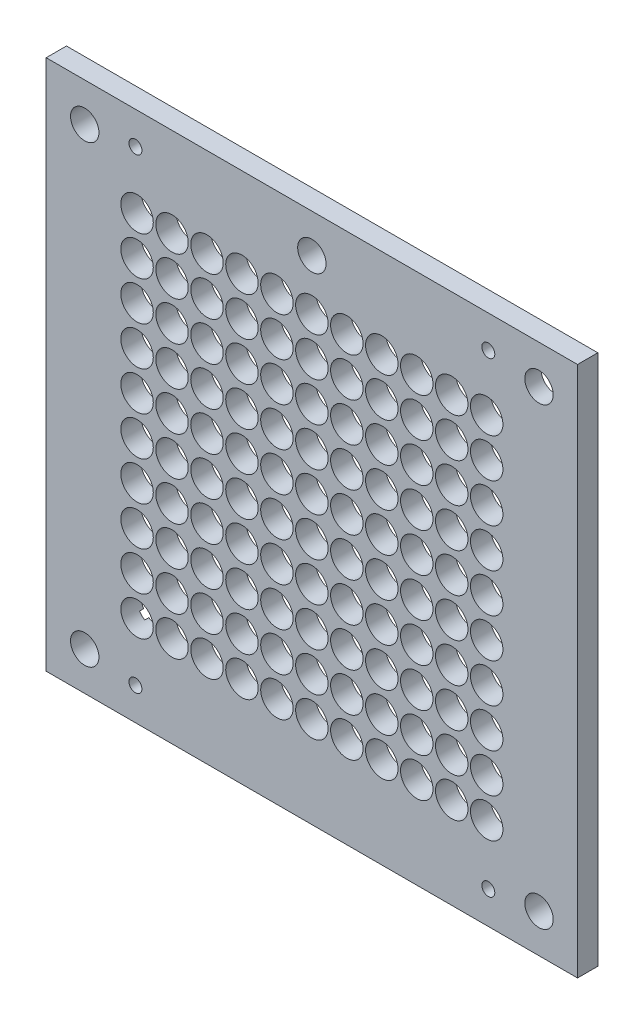
from build123d import *

# Parameters (mm, degrees)
SKIZZE2_W                                            = 131
SKIZZE2_H                                            = 131
AUFSATZ_LINEAR_AUSTRAGEN1_DEPTH                      = 5
SKIZZE3_R                                            = 3.5
SCHNITT_LINEAR_AUSTRAGEN1_DEPTH                      = 5
SKIZZE4_R                                            = 4
SCHNITT_LINEAR_AUSTRAGEN2_DEPTH                      = 5
LINEARES_MUSTER1_COUNT                               = 6
LINEARES_MUSTER1_PITCH                               = 8.62
LINEARES_MUSTER1_COUNT_DIR2                          = 10
LINEARES_MUSTER1_PITCH_DIR2                          = 9.611111111
LINEARES_MUSTER2_COUNT                               = 6
LINEARES_MUSTER2_PITCH                               = 8.62
LINEARES_MUSTER2_COUNT_DIR2                          = 10
LINEARES_MUSTER2_PITCH_DIR2                          = 9.611111111
SKIZZE5_R                                            = 6
SCHNITT_LINEAR_AUSTRAGEN3_DEPTH                      = 1
SKIZZE6_R                                            = 3.5
SCHNITT_LINEAR_AUSTRAGEN4_DEPTH                      = 5
SKIZZE7_R                                            = 3
SCHNITT_LINEAR_AUSTRAGEN5_DEPTH                      = 1.2
FORMSENKUNG_F_R_M3_SENKSCHRAUBE_MIT_INNE_D           = 3.2
FORMSENKUNG_F_R_M3_SENKSCHRAUBE_MIT_INNE_CSINK_D     = 7.94
FORMSENKUNG_F_R_M3_SENKSCHRAUBE_MIT_INNE_CSINK_ANGLE = 90


with BuildPart() as part:
    # Skizze2 → Aufsatz-Linear austragen1 (new body)
    with BuildSketch(Plane.XY):
        Rectangle(SKIZZE2_W, SKIZZE2_H)
    extrude(amount=AUFSATZ_LINEAR_AUSTRAGEN1_DEPTH)

    # Skizze3 → Schnitt-Linear austragen1 (cut)
    with BuildSketch(Plane(origin=(0, 0, 0), x_dir=(-1, 0, 0), z_dir=(0, 0, -1))):
        with Locations((0, 56)):
            Circle(SKIZZE3_R)
    extrude(amount=-SCHNITT_LINEAR_AUSTRAGEN1_DEPTH, mode=Mode.SUBTRACT)

    # Skizze4 → Schnitt-Linear austragen2 (cut)
    with BuildSketch(Plane(origin=(0, 0, 0), x_dir=(-1, 0, 0), z_dir=(0, 0, -1))):
        with Locations((0, 43.5)):
            Circle(SKIZZE4_R)
    schnitt_linear_austragen2 = extrude(amount=-SCHNITT_LINEAR_AUSTRAGEN2_DEPTH, mode=Mode.SUBTRACT)

    # Lineares Muster1: Schnitt-Linear austragen2 6 × 10
    with Locations(*[(i * LINEARES_MUSTER1_PITCH, -j * LINEARES_MUSTER1_PITCH_DIR2, 0) for i in range(LINEARES_MUSTER1_COUNT) for j in range(LINEARES_MUSTER1_COUNT_DIR2) if (i, j) != (0, 0)]):
        add(schnitt_linear_austragen2, mode=Mode.SUBTRACT)

    # Lineares Muster2: Schnitt-Linear austragen2 6 × 10, 9 skipped
    with Locations(*[(-i * LINEARES_MUSTER2_PITCH, -j * LINEARES_MUSTER2_PITCH_DIR2, 0) for i in range(LINEARES_MUSTER2_COUNT) for j in range(LINEARES_MUSTER2_COUNT_DIR2) if (i, j) not in ((0, 0), (0, 1), (0, 2), (0, 3), (0, 4), (0, 5), (0, 6), (0, 7), (0, 8), (0, 9))]):
        add(schnitt_linear_austragen2, mode=Mode.SUBTRACT)

    # Skizze5 → Schnitt-Linear austragen3 (cut)
    with BuildSketch(Plane(origin=(0, 0, 0), x_dir=(-1, 0, 0), z_dir=(0, 0, -1))):
        with Locations((-50, 50)):
            Circle(SKIZZE5_R)
        with Locations((50, 50)):
            Circle(SKIZZE5_R)
        with Locations((-50, -50)):
            Circle(SKIZZE5_R)
        with Locations((50, -50)):
            Circle(SKIZZE5_R)
    extrude(amount=-SCHNITT_LINEAR_AUSTRAGEN3_DEPTH, mode=Mode.SUBTRACT)

    # Skizze6 → Schnitt-Linear austragen4 (cut)
    with BuildSketch(Plane(origin=(0, 0, 0), x_dir=(-1, 0, 0), z_dir=(0, 0, -1))):
        with Locations(Location((-56, 56, 0), (0, 0, 350.675693895))):
            Circle(SKIZZE6_R)
        with Locations(Location((-56, -56, 0), (0, 0, 9.324306105))):
            Circle(SKIZZE6_R)
        with Locations(Location((56, -56, 0), (0, 0, 99.324306105))):
            Circle(SKIZZE6_R)
        with Locations(Location((56, 56, 0), (0, 0, 260.675693895))):
            Circle(SKIZZE6_R)
    extrude(amount=-SCHNITT_LINEAR_AUSTRAGEN4_DEPTH, mode=Mode.SUBTRACT)

    # Skizze7 → Schnitt-Linear austragen5 (cut)
    with BuildSketch(Plane(origin=(0, 0, 1), x_dir=(-1, 0, 0), z_dir=(0, 0, -1))):
        with Locations((-50, 50)):
            Circle(SKIZZE7_R)
        with Locations((50, 50)):
            Circle(SKIZZE7_R)
        with Locations((50, -50)):
            Circle(SKIZZE7_R)
        with Locations((-50, -50)):
            Circle(SKIZZE7_R)
    extrude(amount=-SCHNITT_LINEAR_AUSTRAGEN5_DEPTH, mode=Mode.SUBTRACT)

    # Formsenkung für M3 Senkschraube mit Innensechskant1 (through all)
    with Locations(Plane(origin=(0, 0, 0), x_dir=(-1, 0, 0), z_dir=(0, 0, -1))):
        with Locations((-43.5, 57.5), (43.5, 57.5), (43.5, -57.5), (-43.5, -57.5)):
            CounterSinkHole(FORMSENKUNG_F_R_M3_SENKSCHRAUBE_MIT_INNE_D / 2, FORMSENKUNG_F_R_M3_SENKSCHRAUBE_MIT_INNE_CSINK_D / 2, counter_sink_angle=FORMSENKUNG_F_R_M3_SENKSCHRAUBE_MIT_INNE_CSINK_ANGLE)


solid = part.part
